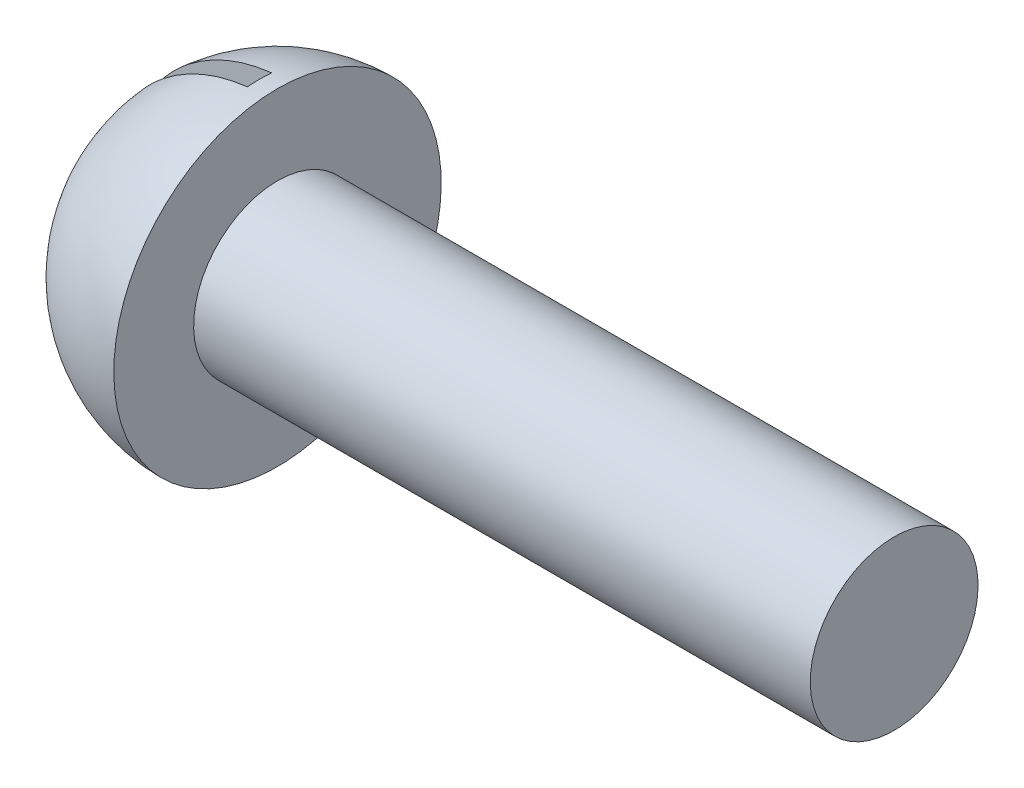
from build123d import *

# Parameters (mm, degrees)
SKETCH2_W          = 0.5
SKETCH2_H          = 8.749412665
CUT_EXTRUDE1_DEPTH = 3


with BuildPart() as part:
    # Sketch1 → Revolve3 (revolve)
    with BuildSketch(Plane.XY):
        with BuildLine():
            Line((12.7, 0), (12.7, 1.7272))
            Line((12.7, 1.7272), (0, 1.7272))
            Line((0, 1.7272), (0, 3.371476925))
            ThreePointArc((0, 3.371476925), (-2.383994197, 2.383994197), (-3.371476925, 0))
            Line((-3.371476925, 0), (12.7, 0))
        make_face()
    revolve(axis=Axis((25.331759203, 0, 0), (-1, 0, 0)))

    # Sketch2 → Cut-Extrude1 (cut)
    with BuildSketch(Plane.ZY.offset(3.371476925)):
        with Locations((0, -0.032949338)):
            Rectangle(SKETCH2_W, SKETCH2_H)
    extrude(amount=-CUT_EXTRUDE1_DEPTH, mode=Mode.SUBTRACT)


solid = part.part
